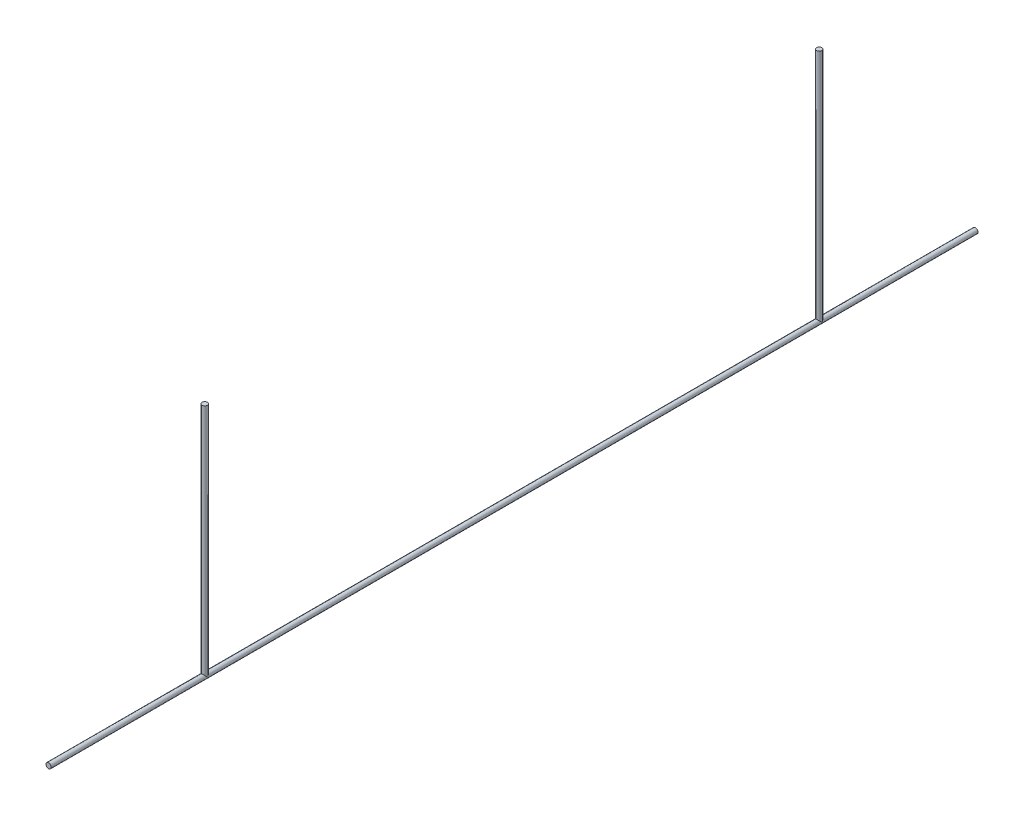
from build123d import *

# Parameters (mm, degrees)
SKETCH_1_R      = 5
EXTRUDE_1_DEPTH = 1780
SKETCH_2_R      = 5
EXTRUDE_2_DEPTH = 452


with BuildPart() as part:
    # 草图1 → 凸台-拉伸1 (new body)
    with BuildSketch(Plane.XY):
        Circle(SKETCH_1_R)
    extrude(amount=EXTRUDE_1_DEPTH)

    # 草图2 → 凸台-拉伸2 (add)
    with BuildSketch(Plane(origin=(0, 0, 0), x_dir=(1, 0, 0), z_dir=(0, 1, 0))):
        with Locations((0, -300)):
            Circle(SKETCH_2_R)
        with Locations((0, -1480)):
            Circle(SKETCH_2_R)
    extrude(amount=EXTRUDE_2_DEPTH)


solid = part.part
